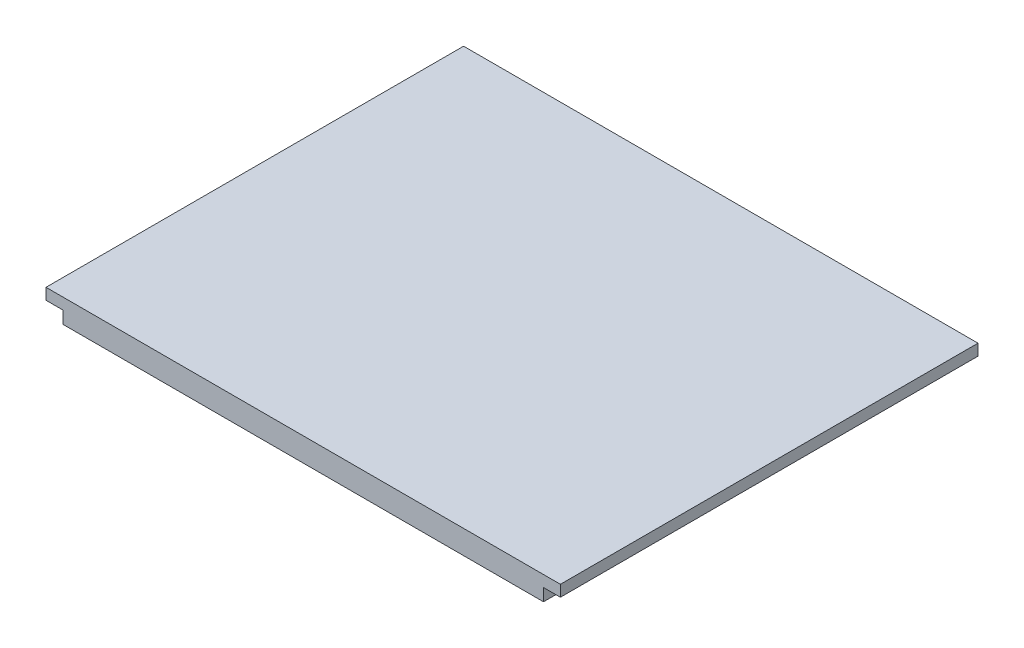
from build123d import *

# Parameters (mm, degrees)
BOSS_EXTRUDE1_DEPTH = 74.2


with BuildPart() as part:
    # Sketch2 → Boss-Extrude1 (new body)
    with BuildSketch(Plane.XY):
        Polygon((42.7, 0), (-42.7, 0), (-42.7, 2.2), (-45.7, 2.2), (-45.7, 4.2), (45.7, 4.2), (45.7, 2.2), (42.7, 2.2), align=None)
    extrude(amount=BOSS_EXTRUDE1_DEPTH)


solid = part.part
